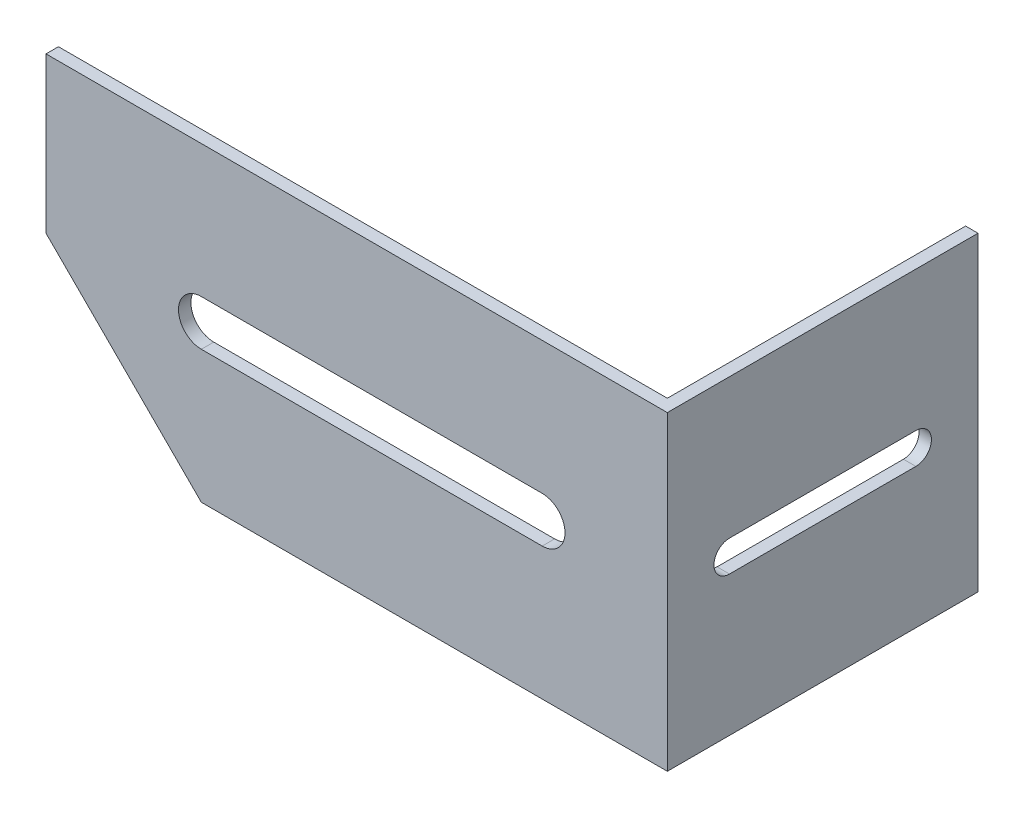
from build123d import *

# Parameters (mm, degrees)
BOSS_EXTRUDE1_DEPTH = 50
SHELL2_T            = -2
CUT_EXTRUDE1_DEPTH  = 60


with BuildPart() as part:
    # Sketch1 → Boss-Extrude1 (new body)
    with BuildSketch(Plane.XY):
        Polygon((-100, 25), (-75, 0), (0, 0), (0, 50), (-100, 50), align=None)
        with BuildLine():
            ThreePointArc((-75, 21.327014218), (-78.672985782, 25), (-75, 28.672985782))
            Line((-75, 28.672985782), (-20.142180095, 28.672985782))
            ThreePointArc((-20.142180095, 28.672985782), (-16.469194313, 25), (-20.142180095, 21.327014218))
            Line((-20.142180095, 21.327014218), (-75, 21.327014218))
        make_face(mode=Mode.SUBTRACT)
    extrude(amount=BOSS_EXTRUDE1_DEPTH)

    # Shell2
    shell2_openings = [part.faces().sort_by_distance(p)[0] for p in [
        (-87.5, 12.5, 25),
        (-37.5, 0, 25),
        (-50, 50, 25),
        (-100, 37.5, 25),
        (-78.672985782, 25, 25),
        (-47.571090047, 28.672985782, 25),
        (-16.469194313, 25, 25),
        (-47.571090047, 21.327014218, 25),
        (-86.709430585, 13.290569415, 0),
    ]]
    offset(amount=SHELL2_T, openings=shell2_openings, kind=Kind.INTERSECTION)

    # Sketch2 → Cut-Extrude1 (cut)
    with BuildSketch(Plane(origin=(0, 0, 0), x_dir=(0, 0, -1), z_dir=(1, 0, 0))):
        with BuildLine():
            Line((-40, 27.5), (-10, 27.5))
            ThreePointArc((-10, 27.5), (-7.5, 25), (-10, 22.5))
            Line((-10, 22.5), (-40, 22.5))
            ThreePointArc((-40, 22.5), (-42.5, 25), (-40, 27.5))
        make_face()
    extrude(amount=-CUT_EXTRUDE1_DEPTH, mode=Mode.SUBTRACT)


solid = part.part
